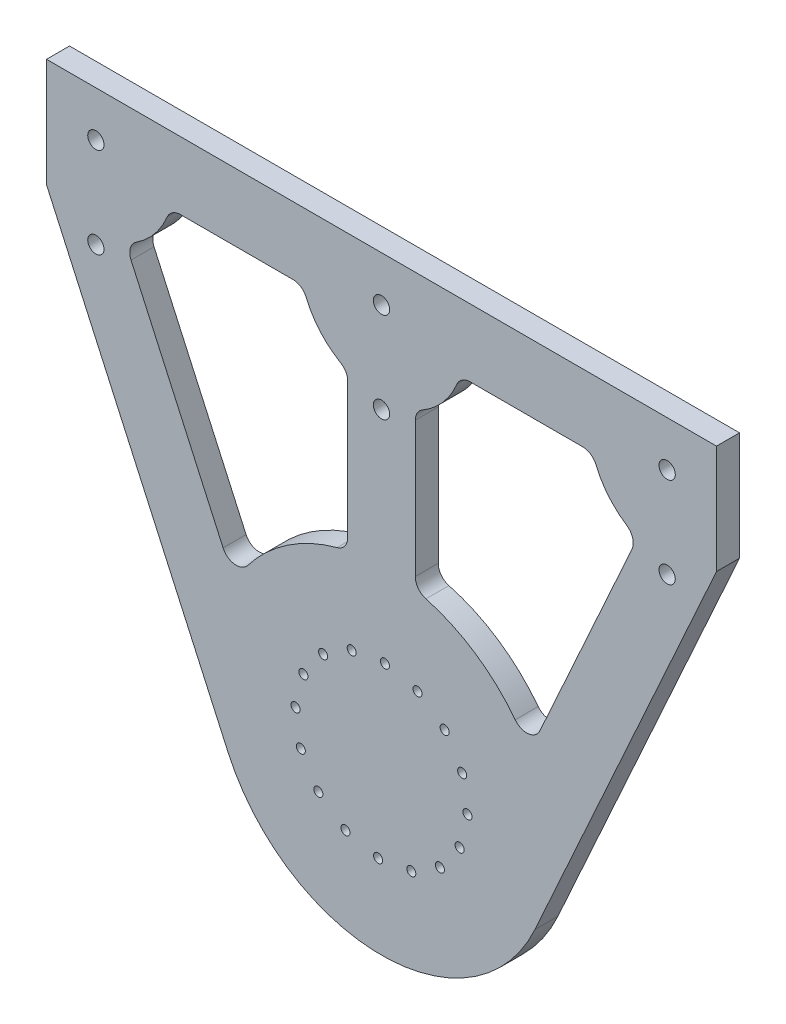
from build123d import *

# Parameters (mm, degrees)
BOSS_EXTRUDE1_DEPTH     = 3.175
CUT_EXTRUDE2_DEPTH      = 153.835933275
CUT_EXTRUDE2_DEPTH_BACK = 153.835933275
SKETCH3_R               = 1.25
CUT_EXTRUDE6_DEPTH      = 153.835933275
CUT_EXTRUDE6_DEPTH_BACK = 153.835933275
SKETCH12_R              = 2.25
CUT_EXTRUDE7_DEPTH      = 153.835933275
CUT_EXTRUDE7_DEPTH_BACK = 153.835933275
FILLET4_R               = 4
BOSS_EXTRUDE2_START     = -6.35
SKETCH16_R              = 2.25
BOSS_EXTRUDE2_DEPTH     = 6.35
CUT_EXTRUDE8_DEPTH      = 153.835933275
CUT_EXTRUDE8_DEPTH_BACK = 153.835933275
SKETCH17_R              = 2.25


with BuildPart() as part:
    # Sketch1 → Boss-Extrude1 (new, symmetric)
    with BuildSketch(Plane.XY):
        with BuildLine():
            Line((92.5, 121.5), (-92.5, 121.5))
            Line((-92.5, 121.5), (-92.5, 91.5))
            Line((-92.5, 91.5), (-42.356397926, -19.188161838))
            ThreePointArc((-42.356397926, -19.188161838), (0, -46.5), (42.356397926, -19.188161838))
            Line((42.356397926, -19.188161838), (92.5, 91.5))
            Line((92.5, 91.5), (92.5, 121.5))
        make_face()
    extrude(amount=BOSS_EXTRUDE1_DEPTH, both=True)

    # Sketch3 → Cut-Extrude2 (cut, two sides: drawn at the far end of the back side and taken through both)
    with BuildSketch(Plane(origin=(0, 0, -3.175), x_dir=(-1, 0, 0), z_dir=(0, 0, -1)).offset(-CUT_EXTRUDE2_DEPTH_BACK)):
        with Locations((17.440159599, -16.121517706)):
            Circle(SKETCH3_R)
        with Locations((22.282044228, -8.220280106)):
            Circle(SKETCH3_R)
        with Locations((9.943168767, -21.568400378)):
            Circle(SKETCH3_R)
        with Locations((0.932420624, -23.731689611)):
            Circle(SKETCH3_R)
        with Locations((-8.220280106, -22.282044228)):
            Circle(SKETCH3_R)
        with Locations((-16.121517706, -17.440159599)):
            Circle(SKETCH3_R)
        with Locations((-21.568400378, -9.943168767)):
            Circle(SKETCH3_R)
        with Locations((-23.731689611, -0.932420624)):
            Circle(SKETCH3_R)
        with Locations((-22.282044228, 8.220280106)):
            Circle(SKETCH3_R)
        with Locations((-17.440159599, 16.121517706)):
            Circle(SKETCH3_R)
        with Locations((-9.943168767, 21.568400378)):
            Circle(SKETCH3_R)
        with Locations((-0.932420624, 23.731689611)):
            Circle(SKETCH3_R)
        with Locations((8.220280106, 22.282044228)):
            Circle(SKETCH3_R)
        with Locations((16.121517706, 17.440159599)):
            Circle(SKETCH3_R)
        with Locations((21.568400378, 9.943168767)):
            Circle(SKETCH3_R)
        with Locations((23.731689611, 0.932420624)):
            Circle(SKETCH3_R)
    extrude(amount=CUT_EXTRUDE2_DEPTH + CUT_EXTRUDE2_DEPTH_BACK, mode=Mode.SUBTRACT)

    # Sketch12 → Cut-Extrude6 (cut, two sides: drawn at the far end of the back side and taken through both)
    with BuildSketch(Plane(origin=(0, 0, -3.175), x_dir=(-1, 0, 0), z_dir=(0, 0, -1)).offset(-CUT_EXTRUDE6_DEPTH_BACK)):
        with Locations((-7, 102)):
            Circle(SKETCH12_R)
        with Locations((7, 102)):
            Circle(SKETCH12_R)
        with Locations((7, 116)):
            Circle(SKETCH12_R)
        with Locations((-87, 116)):
            Circle(SKETCH12_R)
        with Locations((-73, 116)):
            Circle(SKETCH12_R)
        with Locations((-73, 102)):
            Circle(SKETCH12_R)
        with Locations((-87, 102)):
            Circle(SKETCH12_R)
        with Locations(Location((87, 102, 0), (0, 0, 180))):
            Circle(SKETCH12_R)
        with Locations(Location((73, 102, 0), (0, 0, 180))):
            Circle(SKETCH12_R)
        with Locations(Location((73, 116, 0), (0, 0, 180))):
            Circle(SKETCH12_R)
        with Locations(Location((87, 116, 0), (0, 0, 180))):
            Circle(SKETCH12_R)
        with Locations((-7, 116)):
            Circle(SKETCH12_R)
    extrude(amount=CUT_EXTRUDE6_DEPTH + CUT_EXTRUDE6_DEPTH_BACK, mode=Mode.SUBTRACT)

    # Sketch13 → Cut-Extrude7 (cut, two sides: drawn at the far end of the back side and taken through both)
    with BuildSketch(Plane(origin=(0, 0, -3.175), x_dir=(-1, 0, 0), z_dir=(0, 0, -1)).offset(-CUT_EXTRUDE7_DEPTH_BACK)):
        with BuildLine():
            Line((-40.739222198, 22.417978828), (-70.6841661, 88.519149462))
            ThreePointArc((-70.6841661, 88.519149462), (-62.939709446, 94.330423107), (-58.354481954, 102.85821292))
            Line((-58.354481954, 102.85821292), (-21.645518046, 102.85821292))
            ThreePointArc((-21.645518046, 102.85821292), (-17.06210253, 94.332530646), (-9.32089354, 88.521451623))
            Line((-9.32089354, 88.521451623), (-9.32089354, 45.556239349))
            ThreePointArc((-9.32089354, 45.556239349), (-27.574418795, 37.441974148), (-40.739222198, 22.417978828))
        make_face()
        with BuildLine():
            Line((40.739222198, 22.417978828), (70.6841661, 88.519149462))
            ThreePointArc((70.6841661, 88.519149462), (62.939709446, 94.330423107), (58.354481954, 102.85821292))
            Line((58.354481954, 102.85821292), (21.645518046, 102.85821292))
            ThreePointArc((21.645518046, 102.85821292), (17.06210253, 94.332530646), (9.32089354, 88.521451623))
            Line((9.32089354, 88.521451623), (9.32089354, 45.556239349))
            ThreePointArc((9.32089354, 45.556239349), (27.574418795, 37.441974148), (40.739222198, 22.417978828))
        make_face()
    extrude(amount=CUT_EXTRUDE7_DEPTH + CUT_EXTRUDE7_DEPTH_BACK, mode=Mode.SUBTRACT)

    # Fillet4
    fillet4_edges = [part.edges().sort_by_distance(p)[0] for p in [
        (-58.354481954, 102.85821292, 0),
        (-70.6841661, 88.519149462, 0),
        (-40.739222198, 22.417978828, 0),
        (-9.32089354, 45.556239349, 0),
        (-9.32089354, 88.521451623, 0),
        (-21.645518046, 102.85821292, 0),
        (70.6841661, 88.519149462, 0),
        (58.354481954, 102.85821292, 0),
        (21.645518046, 102.85821292, 0),
        (9.32089354, 88.521451623, 0),
        (9.32089354, 45.556239349, 0),
        (40.739222198, 22.417978828, 0),
    ]]
    fillet(fillet4_edges, radius=FILLET4_R)

    # Sketch16 → Boss-Extrude2 (add)
    with BuildSketch(Plane.XY.offset(3.175).offset(BOSS_EXTRUDE2_START)):
        with Locations((-87, 102)):
            Circle(SKETCH16_R)
        with Locations((-87, 116)):
            Circle(SKETCH16_R)
        with Locations((-73, 116)):
            Circle(SKETCH16_R)
        with Locations((-73, 102)):
            Circle(SKETCH16_R)
        with Locations((-7, 116)):
            Circle(SKETCH16_R)
        with Locations((7, 116)):
            Circle(SKETCH16_R)
        with Locations((-7, 102)):
            Circle(SKETCH16_R)
        with Locations((7, 102)):
            Circle(SKETCH16_R)
        with Locations((73, 102)):
            Circle(SKETCH16_R)
        with Locations((87, 102)):
            Circle(SKETCH16_R)
        with Locations((73, 116)):
            Circle(SKETCH16_R)
        with Locations((87, 116)):
            Circle(SKETCH16_R)
    extrude(amount=BOSS_EXTRUDE2_DEPTH)

    # Sketch17 → Cut-Extrude8 (cut, two sides: drawn at the far end of the back side and taken through both)
    with BuildSketch(Plane(origin=(0, 0, -3.175), x_dir=(-1, 0, 0), z_dir=(0, 0, -1)).offset(-CUT_EXTRUDE8_DEPTH_BACK)):
        with Locations((78.869644454, 84)):
            Circle(SKETCH17_R)
        with Locations((0, 84)):
            Circle(SKETCH17_R)
        with Locations(Location((-78.869644454, 84, 0), (0, 0, 180))):
            Circle(SKETCH17_R)
        with Locations((0, 109)):
            Circle(SKETCH17_R)
        with Locations((-78.869644454, 109)):
            Circle(SKETCH17_R)
        with Locations((78.869644454, 109)):
            Circle(SKETCH17_R)
    extrude(amount=CUT_EXTRUDE8_DEPTH + CUT_EXTRUDE8_DEPTH_BACK, mode=Mode.SUBTRACT)


solid = part.part
